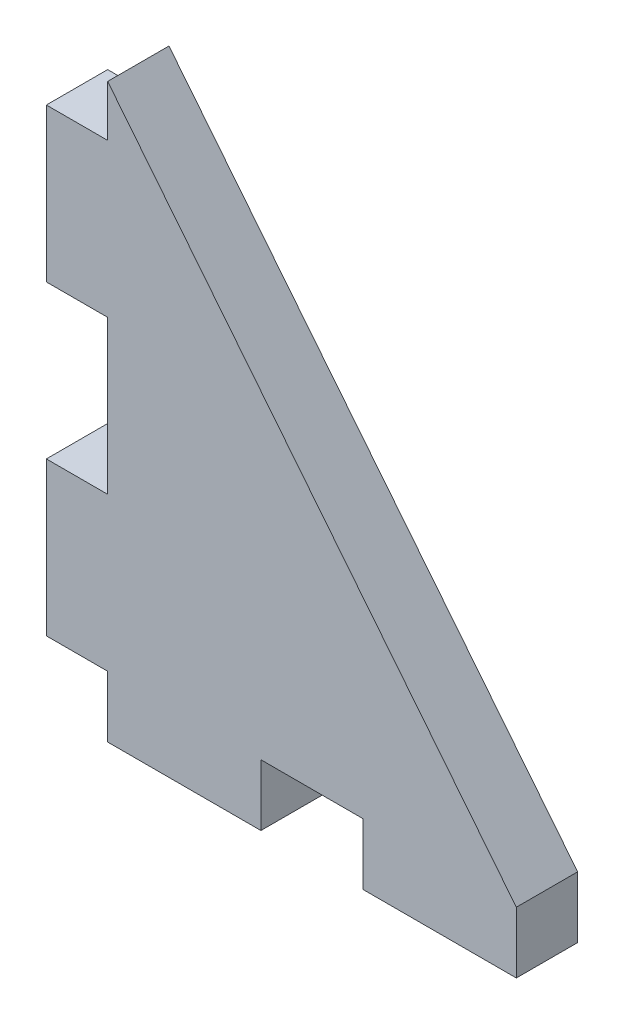
from build123d import *

# Parameters (mm, degrees)
SALIENTE_EXTRUIR1_DEPTH = 3


with BuildPart() as part:
    # Croquis1 → Saliente-Extruir1 (new, symmetric)
    with BuildSketch(Plane.XY):
        Polygon((0, 15), (0, 30), (-6, 30), (-6, 45), (0, 45), (0, 50), (40, 0), (40, -6), (25, -6), (25, 0), (15, 0), (15, -6), (0, -6), (0, 0), (-6, 0), (-6, 15), align=None)
    extrude(amount=SALIENTE_EXTRUIR1_DEPTH, both=True)


solid = part.part
